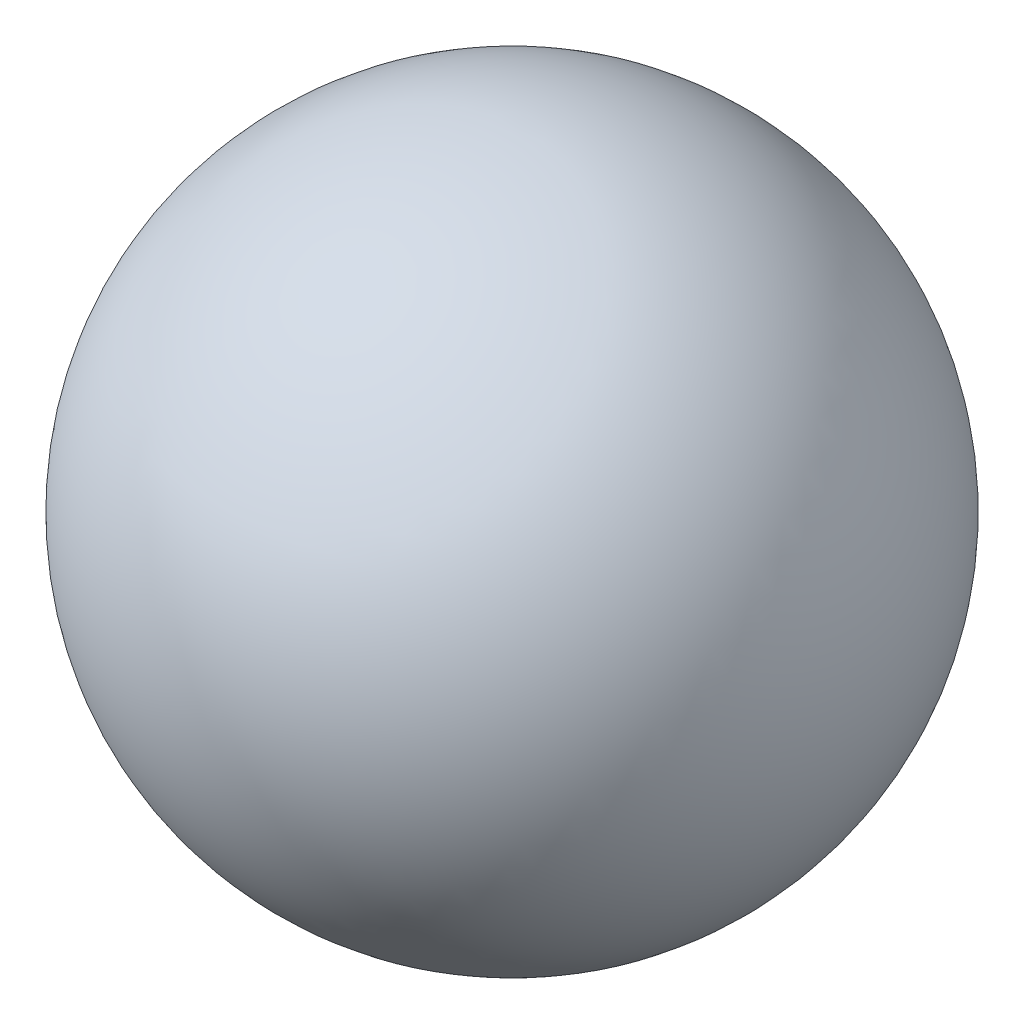
from build123d import *


with BuildPart() as part:
    # Sketch1 → Revolve1 (revolve)
    with BuildSketch(Plane.XY):
        with BuildLine():
            Line((0, 1.75), (0, -1.75))
            ThreePointArc((0, -1.75), (-1.75, 0), (0, 1.75))
        make_face()
    revolve(axis=Axis((0, 1.75, 0), (0, -1, 0)))


solid = part.part
